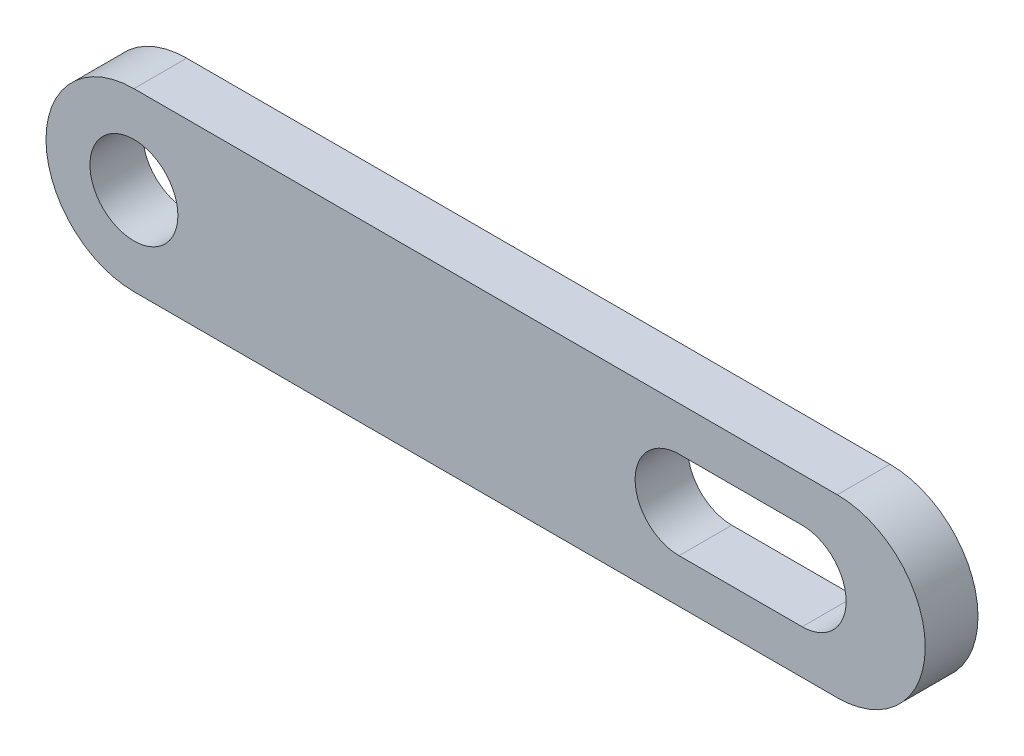
from build123d import *

# Parameters (mm, degrees)
BOSS_EXTRUDE1_DEPTH = 3
CUT_EXTRUDE1_REACH  = 27.671
SKETCH4_R           = 2.5


with BuildPart() as part:
    # Sketch2 → Boss-Extrude1 (new body)
    with BuildSketch(Plane.XY):
        with BuildLine():
            Line((-20, 5), (20, 5))
            ThreePointArc((20, 5), (25, 0), (20, -5))
            Line((20, -5), (-20, -5))
            ThreePointArc((-20, -5), (-25, 0), (-20, 5))
        make_face()
    extrude(amount=BOSS_EXTRUDE1_DEPTH)

    # Sketch4 → Cut-Extrude1 (cut, up to next)
    with BuildSketch(Plane.XY.offset(3), mode=Mode.PRIVATE) as cut_extrude1_sk1:
        with Locations((-20, 0)):
            Circle(SKETCH4_R)
    cut_extrude1_tool1 = extrude(cut_extrude1_sk1.sketch, amount=-CUT_EXTRUDE1_REACH, mode=Mode.PRIVATE) & part.part
    # Sketch4 → Cut-Extrude1 (cut, up to next)
    with BuildSketch(Plane.XY.offset(3), mode=Mode.PRIVATE) as cut_extrude1_sk2:
        with BuildLine():
            Line((11, 2.5), (18, 2.5))
            ThreePointArc((18, 2.5), (20.5, 0), (18, -2.5))
            Line((18, -2.5), (11, -2.5))
            ThreePointArc((11, -2.5), (8.5, 0), (11, 2.5))
        make_face()
    cut_extrude1_tool2 = extrude(cut_extrude1_sk2.sketch, amount=-CUT_EXTRUDE1_REACH, mode=Mode.PRIVATE) & part.part
    add(cut_extrude1_tool1.solids().sort_by_distance((-20, 0, 3))[0], mode=Mode.SUBTRACT)
    add(cut_extrude1_tool2.solids().sort_by_distance((14.5, 0, 3))[0], mode=Mode.SUBTRACT)


solid = part.part
